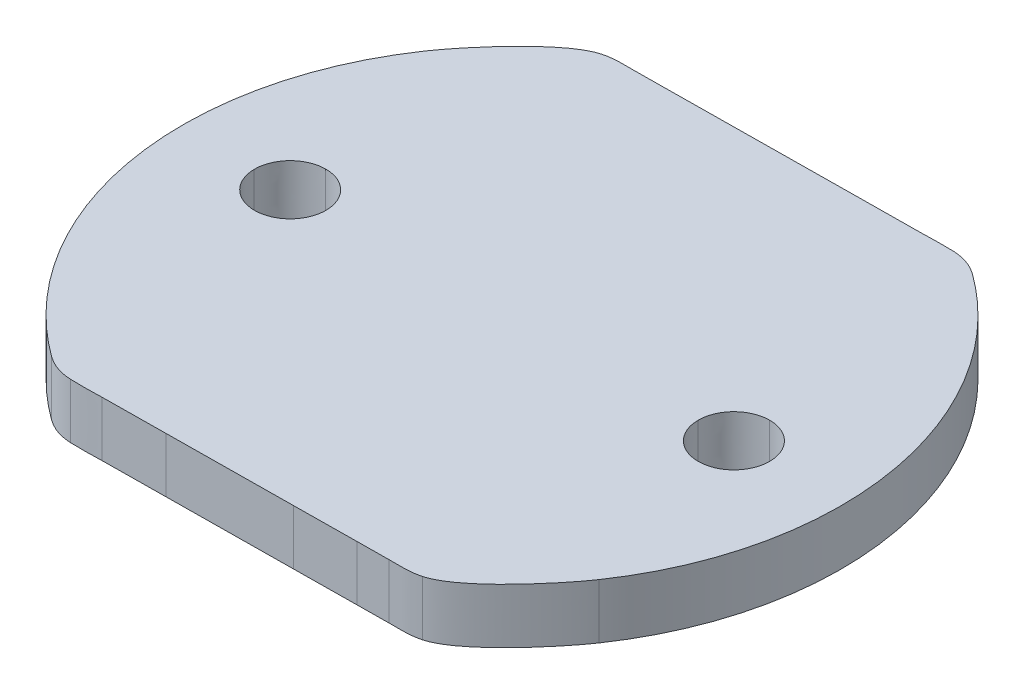
from build123d import *

# Parameters (mm, degrees)
BOSS_EXTRUDE1_DEPTH = 6.35


with BuildPart() as part:
    # Sketch1 → Boss-Extrude1 (new body)
    with BuildSketch(Plane(origin=(0, 0, 0), x_dir=(1, 0, 0), z_dir=(0, 1, 0))):
        with BuildLine():
            Line((60.8717096, 62.8883934), (60.8717096, 62.8914922))
            add(Edge.make_bspline(
                [(60.8717096, 62.8914922), (59.8243914, 63.663195), (58.7701898, 64.0421376), (57.4679572, 64.1179312)],
                knots=[0, 0, 0, 0, 1, 1, 1, 1], degree=3))
            add(Edge.make_bspline(
                [(57.4679572, 64.1179312), (56.2483762, 64.1799326), (55.035704, 64.1029452), (53.8230318, 64.0879338)],
                knots=[0, 0, 0, 0, 1, 1, 1, 1], degree=3))
            add(Edge.make_bspline(
                [(53.8230318, 64.0879338), (51.390804, 64.0629402), (48.9585508, 64.0379212), (46.526323, 64.018922)],
                knots=[0, 0, 0, 0, 1, 1, 1, 1], degree=3))
            add(Edge.make_bspline(
                [(46.526323, 64.018922), (41.661842, 63.963931), (36.797361, 63.9154424), (31.9329054, 63.8674364)],
                knots=[0, 0, 0, 0, 1, 1, 1, 1], degree=3))
            add(Edge.make_bspline(
                [(31.9329054, 63.8674364), (29.4937688, 63.837439), (27.061541, 63.8174238), (24.6292878, 63.7914396)],
                knots=[0, 0, 0, 0, 1, 1, 1, 1], degree=3))
            add(Edge.make_bspline(
                [(24.6292878, 63.7914396), (23.4097322, 63.7764282), (22.19706, 63.7714244), (20.9775044, 63.7564384)],
                knots=[0, 0, 0, 0, 1, 1, 1, 1], degree=3))
            add(Edge.make_bspline(
                [(20.9775044, 63.7564384), (19.7579234, 63.741427), (18.5590434, 63.8389376), (17.3463712, 63.5084328)],
                knots=[0, 0, 0, 0, 1, 1, 1, 1], degree=3))
            add(Edge.make_bspline(
                [(17.3463712, 63.5084328), (13.8599164, 62.5575838), (8.5751416, 56.1841396), (6.8250308, 53.6141422)],
                knots=[0, 0, 0, 0, 1, 1, 1, 1], degree=3))
            add(Edge.make_bspline(
                [(6.8250308, 53.6141422), (-4.716018, 36.6573308), (-0.7610602, 13.6096756), (15.7754066, 1.469136)],
                knots=[0, 0, 0, 0, 1, 1, 1, 1], degree=3))
            add(Edge.make_bspline(
                [(15.7754066, 1.469136), (16.8296082, 0.6974332), (17.876901, 0.3184906), (19.1860424, 0.2495804)],
                knots=[0, 0, 0, 0, 1, 1, 1, 1], degree=3))
            add(Edge.make_bspline(
                [(19.1860424, 0.2495804), (20.3987146, 0.180594), (21.6113868, 0.2545842), (22.8309424, 0.2695956)],
                knots=[0, 0, 0, 0, 1, 1, 1, 1], degree=3))
            add(Edge.make_bspline(
                [(22.8309424, 0.2695956), (25.2563122, 0.2945892), (27.6954234, 0.3195828), (30.1276766, 0.3455924)],
                knots=[0, 0, 0, 0, 1, 1, 1, 1], degree=3))
            add(Edge.make_bspline(
                [(30.1276766, 0.3455924), (34.9921322, 0.3955796), (39.8566132, 0.442087), (44.7210942, 0.490093)],
                knots=[0, 0, 0, 0, 1, 1, 1, 1], degree=3))
            add(Edge.make_bspline(
                [(44.7210942, 0.490093), (47.153322, 0.5200904), (49.5855752, 0.5400802), (52.0246864, 0.5660898)],
                knots=[0, 0, 0, 0, 1, 1, 1, 1], degree=3))
            add(Edge.make_bspline(
                [(52.0246864, 0.5660898), (53.2373586, 0.5810758), (54.4569396, 0.5960872), (55.6696118, 0.601091)],
                knots=[0, 0, 0, 0, 1, 1, 1, 1], degree=3))
            add(Edge.make_bspline(
                [(55.6696118, 0.601091), (56.8891674, 0.616077), (58.0880474, 0.5185918), (59.3076284, 0.8490712)],
                knots=[0, 0, 0, 0, 1, 1, 1, 1], degree=3))
            add(Edge.make_bspline(
                [(59.3076284, 0.8490712), (62.7940578, 1.7999456), (68.0788326, 8.1802732), (69.8220346, 10.7433872)],
                knots=[0, 0, 0, 0, 1, 1, 1, 1], degree=3))
            add(Edge.make_bspline(
                [(69.8220346, 10.7433872), (81.3631088, 27.7001732), (77.408151, 50.7478792), (60.8717096, 62.8883934)],
                knots=[0, 0, 0, 0, 1, 1, 1, 1], degree=3))
        make_face()
        with BuildLine():
            add(Edge.make_bspline(
                [(59.5970106, 32.3954902), (59.6175084, 30.121733), (61.4849164, 28.2889452), (63.7655824, 28.3164788)],
                knots=[0, 0, 0, 0, 1, 1, 1, 1], degree=3))
            add(Edge.make_bspline(
                [(63.7655824, 28.3164788), (66.046223, 28.336494), (67.8721274, 30.2043846), (67.8514772, 32.485076)],
                knots=[0, 0, 0, 0, 1, 1, 1, 1], degree=3))
            add(Edge.make_bspline(
                [(67.8514772, 32.485076), (67.830954, 34.7588332), (65.963546, 36.591621), (63.6829054, 36.5709454)],
                knots=[0, 0, 0, 0, 1, 1, 1, 1], degree=3))
            add(Edge.make_bspline(
                [(63.6829054, 36.5709454), (61.4022394, 36.5409226), (59.5694516, 34.6761308), (59.5970106, 32.3954902)],
                knots=[0, 0, 0, 0, 1, 1, 1, 1], degree=3))
        make_face(mode=Mode.SUBTRACT)
        with BuildLine():
            add(Edge.make_bspline(
                [(17.0569636, 31.9682876), (17.0776138, 29.6876216), (15.2448514, 27.8203914), (12.9710942, 27.7997412)],
                knots=[0, 0, 0, 0, 1, 1, 1, 1], degree=3))
            add(Edge.make_bspline(
                [(12.9710942, 27.7997412), (10.6904282, 27.7747222), (8.823198, 29.6049954), (8.8025224, 31.885636)],
                knots=[0, 0, 0, 0, 1, 1, 1, 1], degree=3))
            add(Edge.make_bspline(
                [(8.8025224, 31.885636), (8.7749634, 34.1593932), (10.6077512, 36.0266234), (12.8884172, 36.0541824)],
                knots=[0, 0, 0, 0, 1, 1, 1, 1], degree=3))
            add(Edge.make_bspline(
                [(12.8884172, 36.0541824), (15.1621744, 36.0741722), (17.0294046, 34.2489282), (17.0569636, 31.9682876)],
                knots=[0, 0, 0, 0, 1, 1, 1, 1], degree=3))
        make_face(mode=Mode.SUBTRACT)
    extrude(amount=BOSS_EXTRUDE1_DEPTH)


solid = part.part
